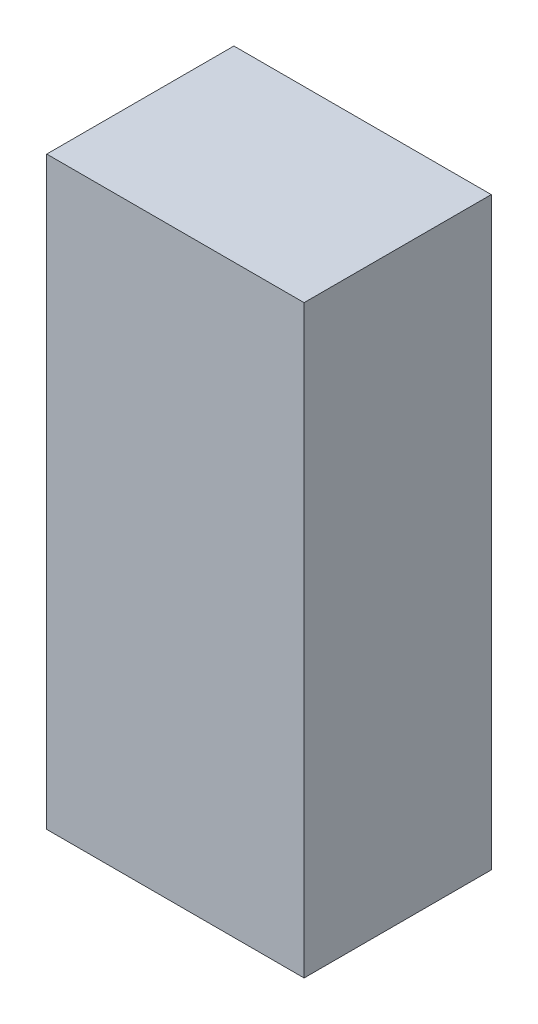
from build123d import *

# Parameters (mm, degrees)
SKETCH1_W           = 66
SKETCH1_H           = 150
BOSS_EXTRUDE1_DEPTH = 24


with BuildPart() as part:
    # Sketch1 → Boss-Extrude1 (new, symmetric)
    with BuildSketch(Plane.XY):
        Rectangle(SKETCH1_W, SKETCH1_H)
    extrude(amount=BOSS_EXTRUDE1_DEPTH, both=True)


solid = part.part
